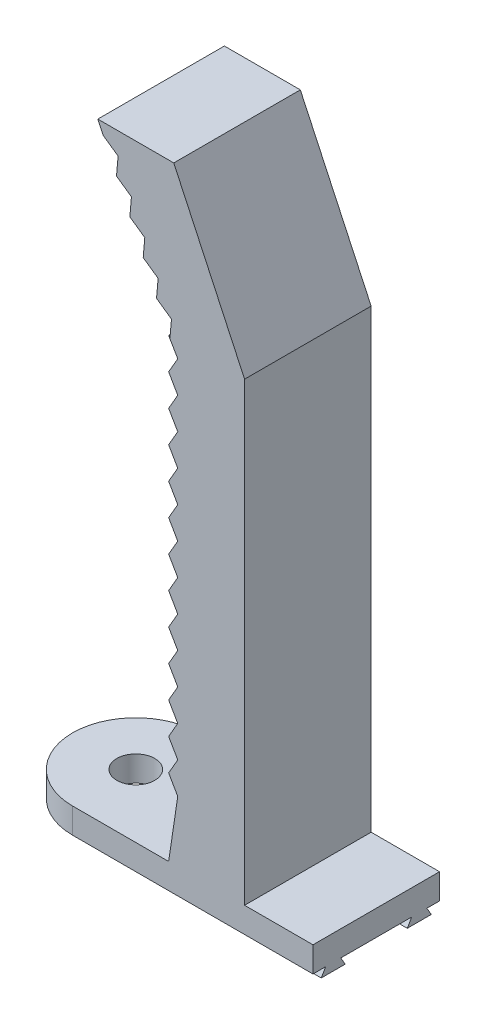
from build123d import *

# Parameters (mm, degrees)
SKETCH1_R           = 7.5
BOSS_EXTRUDE1_DEPTH = 10
BOSS_EXTRUDE2_DEPTH = 80
BOSS_EXTRUDE3_DEPTH = 25
SCALE2_SCALE        = 0.2004
CUT_EXTRUDE9_DEPTH  = 20
CUT_EXTRUDE10_DEPTH = 20


with BuildPart() as part:
    # Sketch1 → Boss-Extrude1 (new body)
    with BuildSketch(Plane(origin=(0, 0, 0), x_dir=(1, 0, 0), z_dir=(0, 1, 0))):
        with BuildLine():
            Line((60, 25), (-35, 25))
            ThreePointArc((-35, 25), (-60, 0), (-35, -25))
            Line((-35, -25), (60, -25))
            Line((60, -25), (60, 25))
        make_face()
        with Locations(Location((-35, 0, 0), (0, 0, 270))):
            Circle(SKETCH1_R, mode=Mode.SUBTRACT)
    extrude(amount=BOSS_EXTRUDE1_DEPTH)

    # Sketch2 → Boss-Extrude2 (add)
    with BuildSketch(Plane(origin=(60, 0, 0), x_dir=(0, 0, -1), z_dir=(1, 0, 0))):
        Polygon((-20, 0), (-21.732050808, -3), (-12.267949192, -3), (-14, 0), align=None)
        Polygon((21.732050808, -3), (12.267949192, -3), (14, 0), (20, 0), align=None)
    extrude(amount=-BOSS_EXTRUDE2_DEPTH)

    # Sketch3 → Boss-Extrude3 (add, symmetric)
    with BuildSketch(Plane.XY):
        Polygon((2.978459489, 10), (2.978459489, 190), (-25, 250), (5, 250), (32.978459489, 190), (32.978459489, 10), align=None)
    extrude(amount=BOSS_EXTRUDE3_DEPTH, both=True)


with BuildPart() as part_1:
    # Scale2: scaled about (13.107002059, 112.272995935, 0)
    add(part.part.scale(SCALE2_SCALE).moved(Location((10.480358846, 89.77348755, 0))))

    # Sketch9 → Cut-Extrude9 (cut)
    with BuildSketch(Plane.XY.offset(5.01)):
        Polygon((11.798929964, 106.59948755), (11.077242128, 107.84948755), (11.077242128, 105.34948755), align=None)
        Polygon((11.798929964, 109.09948755), (11.077242128, 110.34948755), (11.077242128, 107.84948755), align=None)
        Polygon((11.798929964, 104.09948755), (11.077242128, 105.34948755), (11.077242128, 102.84948755), align=None)
        Polygon((11.798929964, 114.09948755), (11.077242128, 115.34948755), (11.077242128, 112.84948755), align=None)
        Polygon((11.798929964, 111.59948755), (11.077242128, 112.84948755), (11.077242128, 110.34948755), align=None)
        Polygon((11.798929964, 116.59948755), (11.077242128, 117.84948755), (11.077242128, 115.34948755), align=None)
        Polygon((11.798929964, 119.09948755), (11.077242128, 120.34948755), (11.077242128, 117.84948755), align=None)
        Polygon((11.798929964, 121.59948755), (11.077242128, 122.84948755), (11.077242128, 120.34948755), align=None)
        Polygon((11.798929964, 124.09948755), (11.077242128, 125.34948755), (11.077242128, 122.84948755), align=None)
        Polygon((11.17570538, 127.638332425), (11.077242128, 127.84948755), (11.077242128, 125.34948755), (11.798929964, 126.59948755), (11.178790887, 127.673599939), align=None)
        Polygon((10.119159725, 129.904101892), (11.077242128, 127.84948755), (11.178790887, 127.673599939), (11.301503859, 129.076215618), align=None)
        Polygon((9.062614071, 132.16987136), (10.119159725, 129.904101892), (10.244958204, 131.341985085), align=None)
        Polygon((8.006068417, 134.435640828), (9.062614071, 132.16987136), (9.18841255, 133.607754553), align=None)
        Polygon((6.949522762, 136.701410295), (8.006068417, 134.435640828), (8.131866896, 135.87352402), align=None)
        Polygon((5.892977108, 138.967179763), (6.949522762, 136.701410295), (7.075321241, 138.139293488), align=None)
        Polygon((11.077242128, 97.84948755), (11.798929964, 96.59948755), (11.077242128, 91.77748755), align=None)
    extrude(amount=-CUT_EXTRUDE9_DEPTH, mode=Mode.SUBTRACT)


with BuildPart() as cut_extrude9_piece_1:
    # of the separate pieces the step leaves, piece 1, a body of its own (cut_extrude9_pieces)
    add(part_1.part.solids().sort_by_distance((3.466358846, 89.77348755, 5.01))[0])

    # Sketch10 → Cut-Extrude10 (cut)
    with BuildSketch(Plane(origin=(0, 0, -5.01), x_dir=(-1, 0, 0), z_dir=(0, 0, -1))):
        Polygon((-11.077242128, 100.34948755), (-11.077242128, 102.84948755), (-11.798929964, 101.59948755), align=None)
        Polygon((-11.077242128, 97.84948755), (-11.077242128, 100.34948755), (-11.798929964, 99.09948755), align=None)
    extrude(amount=-CUT_EXTRUDE10_DEPTH, mode=Mode.SUBTRACT)


with BuildPart() as cut_extrude9_piece_2:
    # of the separate pieces the step leaves, piece 2, a body of its own (cut_extrude9_pieces)
    add(part_1.part.solids().sort_by_distance((11.17570538, 127.638332425, 5.01))[0])


solid = Compound([cut_extrude9_piece_1.part, cut_extrude9_piece_2.part])
